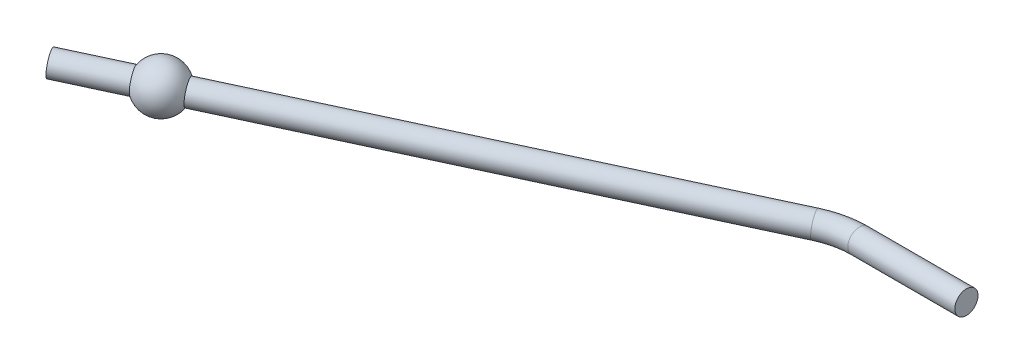
from build123d import *

# Parameters (mm, degrees)
SKETCH1_R = 1.27


with BuildPart() as part:
    # Sweep1: sweep along a curve in space
    with BuildLine() as sweep1_path:
        Line((-68.642810089, 4.223652332, 31.692711576), (-15.557895559, 0.136909795, 1.027320033))
        ThreePointArc((-15.557895559, 0.136909795, 1.027320033), (-13.708278185, 0.034830032, 0.261351566), (-11.721145923, 0, 0))
        Line((-11.721145923, 0, 0), (0, 0, 0))
    # Sketch1 → Sweep1 (sweep)
    with BuildSketch(Plane(origin=(-68.642810089, 4.223652332, 31.692711576), x_dir=(-0.4976253626044802, 0.038309692214518805, -0.8665456514086194), z_dir=(0.8639891352609107, -0.06651420995766534, -0.4990978200962329))):
        Circle(SKETCH1_R)
    sweep(path=sweep1_path.line)

    # Sketch2 → Revolve1 (revolve)
    with BuildSketch(Plane(origin=(-60.961946677, 3.632341006, 27.255731955), x_dir=(-0.4976253626044802, 0.038309692214518805, -0.8665456514086194), z_dir=(0.8639891352609107, -0.06651420995766534, -0.4990978200962329))):
        with BuildLine():
            Line((0, 2.54), (0, -2.54))
            ThreePointArc((0, -2.54), (2.54, 0), (0, 2.54))
        make_face()
    revolve(axis=Axis((-60.766981653, 6.164847401, 27.255731955), (-0.07675788326851926, -0.997049761725129, 0)))


solid = part.part
